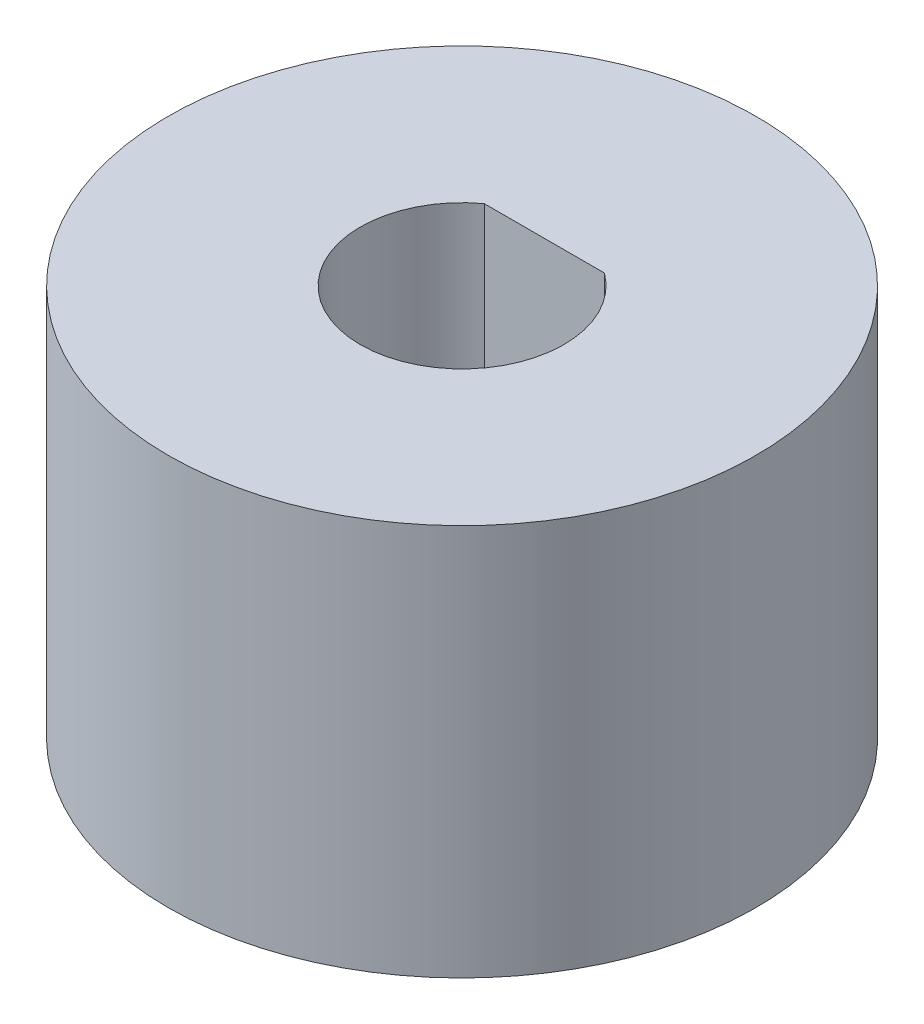
from build123d import *

# Parameters (mm, degrees)
SKETCH1_R           = 7.5
BOSS_EXTRUDE1_DEPTH = 10


with BuildPart() as part:
    # Sketch1 → Boss-Extrude1 (new body)
    with BuildSketch(Plane(origin=(0, 0, 0), x_dir=(1, 0, 0), z_dir=(0, 1, 0))):
        with Locations(Location((0, 0, 0), (0, 0, 270))):
            Circle(SKETCH1_R)
        with BuildLine():
            Line((-1.532970972, 2.1), (1.532970972, 2.1))
            ThreePointArc((1.532970972, 2.1), (0, -2.6), (-1.532970972, 2.1))
        make_face(mode=Mode.SUBTRACT)
    extrude(amount=BOSS_EXTRUDE1_DEPTH)


solid = part.part
